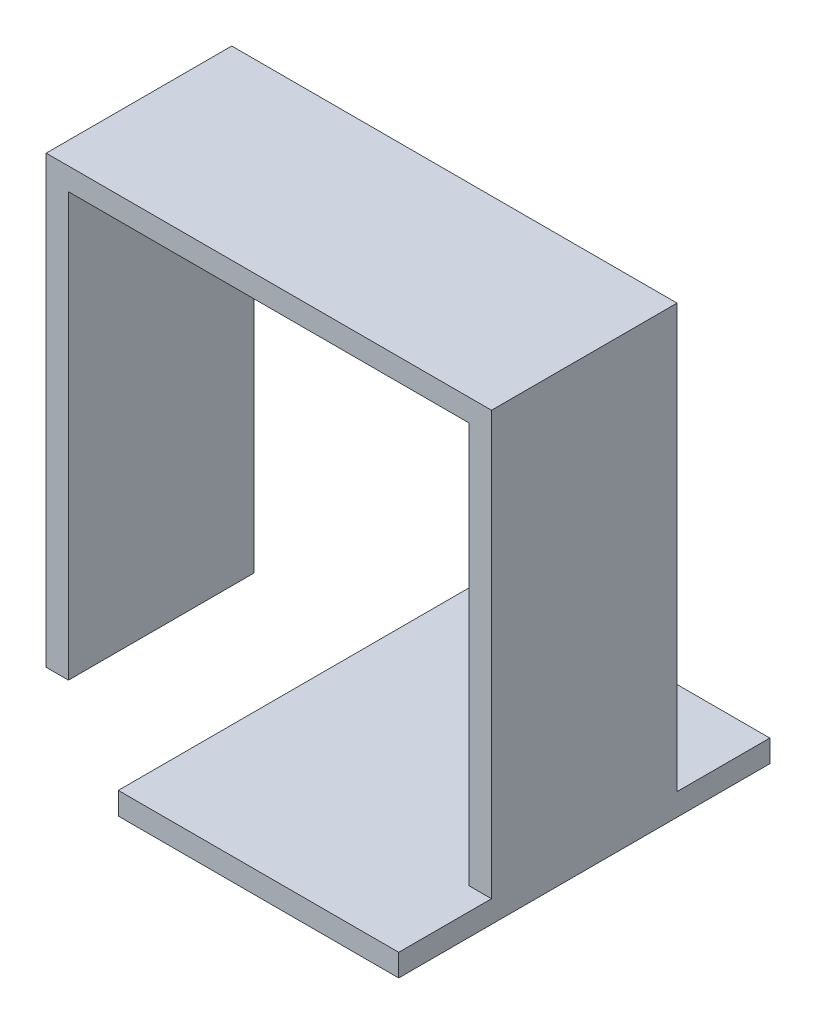
from build123d import *

# Parameters (mm, degrees)
SKETCH1_W               = 30.48
SKETCH1_H               = 25.4
BOSS_EXTRUDE1_DEPTH     = 30.48
SKETCH5_W               = 6.35
SKETCH5_H               = 28.956
CUT_EXTRUDE4_DEPTH      = 47.117696394
CUT_EXTRUDE5_DEPTH      = 40.787452235
CUT_EXTRUDE5_DEPTH_BACK = 40.787452235
SKETCH7_W               = 6.35
SKETCH7_H               = 1.524
CUT_EXTRUDE6_DEPTH      = 31.75


with BuildPart() as part:
    # Sketch1 → Boss-Extrude1 (new body)
    with BuildSketch(Plane(origin=(0, 0, 0), x_dir=(1, 0, 0), z_dir=(0, 1, 0))):
        with Locations((-4.387272727, -3.694545455)):
            Rectangle(SKETCH1_W, SKETCH1_H)
    extrude(amount=BOSS_EXTRUDE1_DEPTH)

    # Sketch5 → Cut-Extrude4 (cut, through all)
    with BuildSketch(Plane(origin=(10.852727273, 0, 0), x_dir=(0, 0, -1), z_dir=(1, 0, 0))):
        with Locations((-13.219545455, 16.002)):
            Rectangle(SKETCH5_W, SKETCH5_H)
        with Locations((5.830454545, 16.002)):
            Rectangle(SKETCH5_W, SKETCH5_H)
    extrude(amount=-CUT_EXTRUDE4_DEPTH, mode=Mode.SUBTRACT)

    # Sketch6 → Cut-Extrude5 (cut, two sides: drawn at the far end of the back side and taken through both)
    with BuildSketch(Plane.XY.offset(-CUT_EXTRUDE5_DEPTH_BACK)):
        Polygon((-18.103272727, 0), (-18.103272727, 28.956), (9.328727273, 28.956), (9.328727273, 1.524), (-8.342365858, 1.524), (-8.342365858, 0), align=None)
    extrude(amount=CUT_EXTRUDE5_DEPTH + CUT_EXTRUDE5_DEPTH_BACK, mode=Mode.SUBTRACT)

    # Sketch7 → Cut-Extrude6 (cut)
    with BuildSketch(Plane(origin=(-18.103272727, 0, 0), x_dir=(0, 0, -1), z_dir=(1, 0, 0))):
        with Locations((-13.219545455, 0.762)):
            Rectangle(SKETCH7_W, SKETCH7_H)
        with Locations((5.830454545, 0.762)):
            Rectangle(SKETCH7_W, SKETCH7_H)
    extrude(amount=-CUT_EXTRUDE6_DEPTH, mode=Mode.SUBTRACT)


solid = part.part
